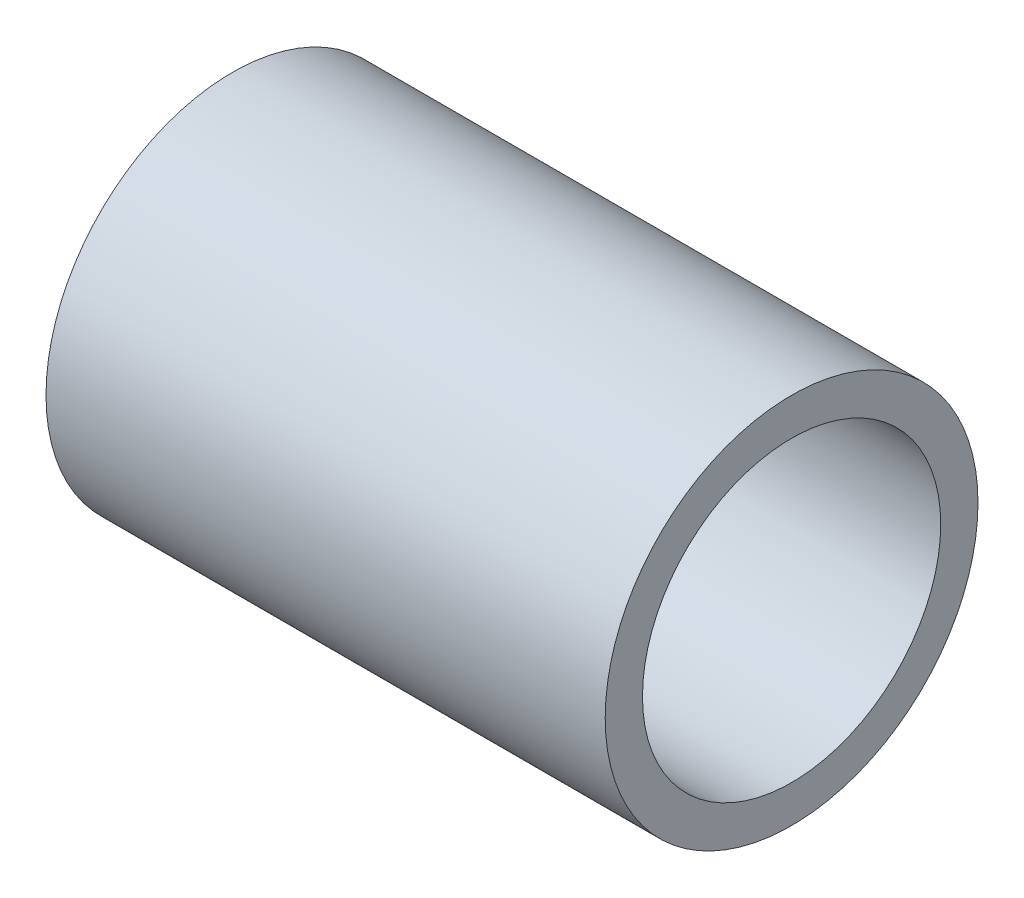
from build123d import *

# Parameters (mm, degrees)
CROQUIS1_R              = 5
CROQUIS1_R_2            = 4
SALIENTE_EXTRUIR1_DEPTH = 15


with BuildPart() as part:
    # Croquis1 → Saliente-Extruir1 (new body)
    with BuildSketch(Plane(origin=(0, 0, 0), x_dir=(0, 0, -1), z_dir=(1, 0, 0))):
        Circle(CROQUIS1_R)
        Circle(CROQUIS1_R_2, mode=Mode.SUBTRACT)
    extrude(amount=SALIENTE_EXTRUIR1_DEPTH)


solid = part.part
